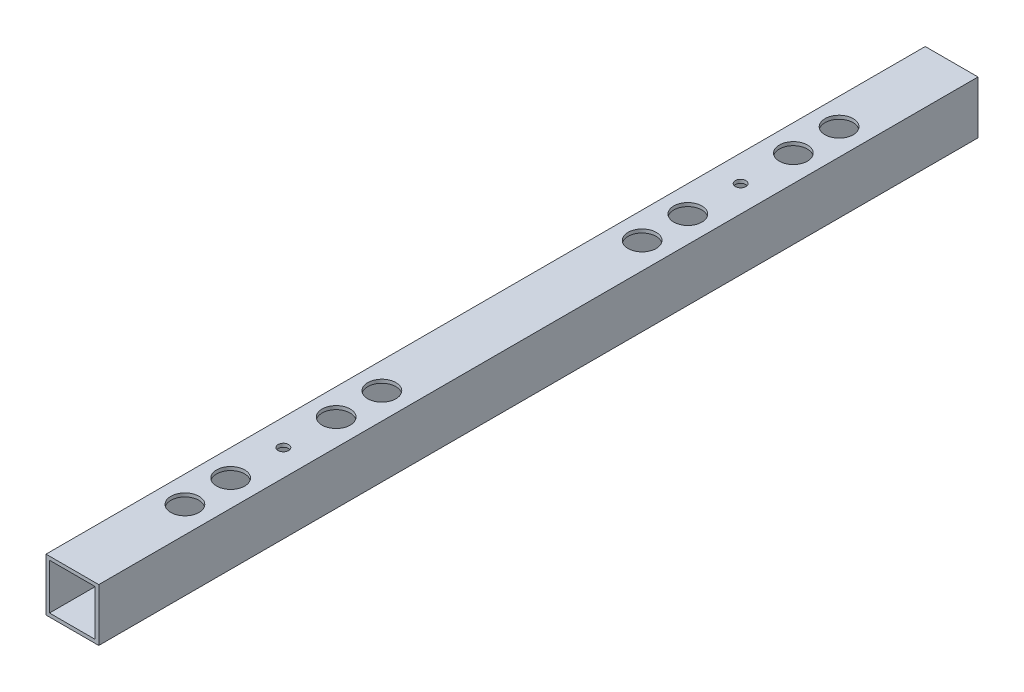
from build123d import *

# Parameters (mm, degrees)
SKETCH_1_W          = 15
SKETCH_1_H          = 15
SKETCH_1_W_2        = 13
SKETCH_1_H_2        = 13
EXTRUDE_1_DEPTH     = 250
SKETCH_2_R          = 1.5
CUT_EXTRUDE_1_DEPTH = 250
SKETCH_3_R          = 4
CUT_EXTRUDE_2_DEPTH = 1.5
SKETCH_4_R          = 4
CUT_EXTRUDE_3_DEPTH = 1.5


with BuildPart() as part:
    # 草图1 → 凸台-拉伸1 (new body)
    with BuildSketch(Plane.XY):
        Rectangle(SKETCH_1_W, SKETCH_1_H)
        Rectangle(SKETCH_1_W_2, SKETCH_1_H_2, mode=Mode.SUBTRACT)
    extrude(amount=EXTRUDE_1_DEPTH)

    # 草图2 → 切除-拉伸1 (cut)
    with BuildSketch(Plane(origin=(0, 7.5, 0), x_dir=(1, 0, 0), z_dir=(0, 1, 0))):
        with Locations((0, -218)):
            Circle(SKETCH_2_R)
        with Locations((0, -205)):
            Circle(SKETCH_2_R)
        with Locations((0, -175)):
            Circle(SKETCH_2_R)
        with Locations((0, -162)):
            Circle(SKETCH_2_R)
        with Locations((0, -190)):
            Circle(SKETCH_2_R)
        with Locations((0, -60)):
            Circle(SKETCH_2_R)
        with Locations((0, -88)):
            Circle(SKETCH_2_R)
        with Locations((0, -75)):
            Circle(SKETCH_2_R)
        with Locations((0, -45)):
            Circle(SKETCH_2_R)
        with Locations((0, -32)):
            Circle(SKETCH_2_R)
    extrude(amount=-CUT_EXTRUDE_1_DEPTH, mode=Mode.SUBTRACT)

    # 草图3 → 切除-拉伸2 (cut)
    with BuildSketch(Plane(origin=(0, 7.5, 0), x_dir=(1, 0, 0), z_dir=(0, 1, 0))):
        with Locations((0, -218)):
            Circle(SKETCH_3_R)
        with Locations((0, -205)):
            Circle(SKETCH_3_R)
        with Locations((0, -75)):
            Circle(SKETCH_3_R)
        with Locations((0, -162)):
            Circle(SKETCH_3_R)
        with Locations((0, -175)):
            Circle(SKETCH_3_R)
        with Locations((0, -88)):
            Circle(SKETCH_3_R)
        with Locations((0, -45)):
            Circle(SKETCH_3_R)
        with Locations((0, -32)):
            Circle(SKETCH_3_R)
    extrude(amount=-CUT_EXTRUDE_2_DEPTH, mode=Mode.SUBTRACT)

    # 草图4 → 切除-拉伸3 (cut)
    with BuildSketch(Plane.XZ.offset(7.5)):
        with Locations((0, 60)):
            Circle(SKETCH_4_R)
        with Locations((0, 190)):
            Circle(SKETCH_4_R)
    extrude(amount=-CUT_EXTRUDE_3_DEPTH, mode=Mode.SUBTRACT)


solid = part.part
